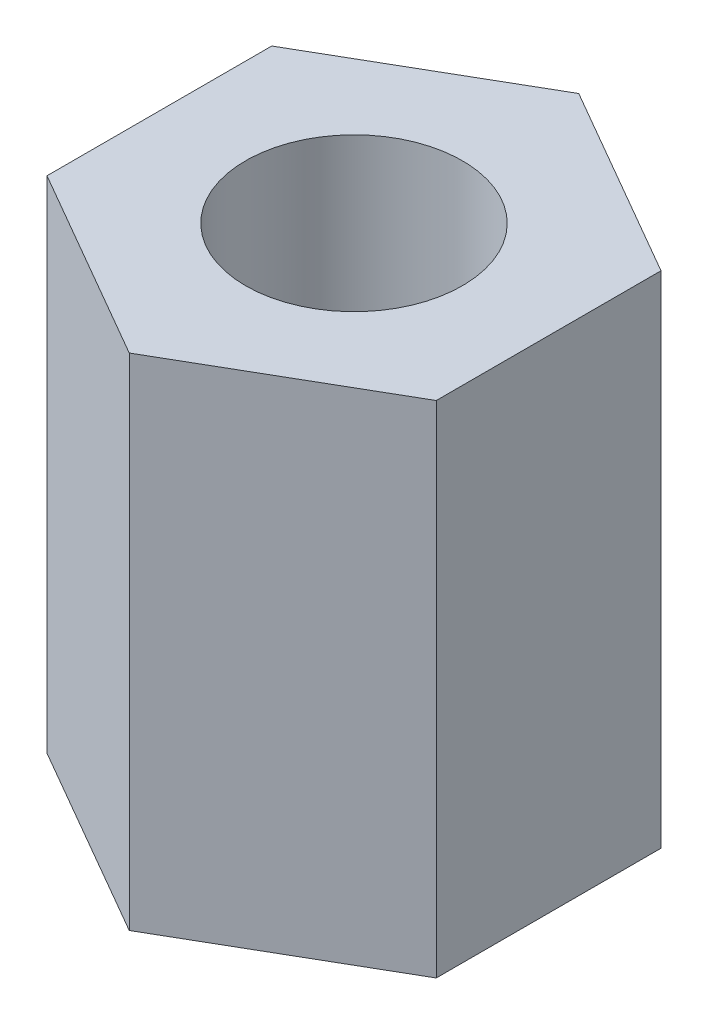
from build123d import *

# Parameters (mm, degrees)
SKETCH1_R           = 1.3
BOSS_EXTRUDE1_DEPTH = 6


with BuildPart() as part:
    # Sketch1 → Boss-Extrude1 (new body)
    with BuildSketch(Plane(origin=(0, 0, 0), x_dir=(1, 0, 0), z_dir=(0, 1, 0))):
        Polygon((0, -2.696225757), (2.335, -1.348112879), (2.335, 1.348112879), (0, 2.696225757), (-2.335, 1.348112879), (-2.335, -1.348112879), align=None)
        with Locations(Location((0, 0, 0), (0, 0, 270))):
            Circle(SKETCH1_R, mode=Mode.SUBTRACT)
    extrude(amount=BOSS_EXTRUDE1_DEPTH)


solid = part.part
